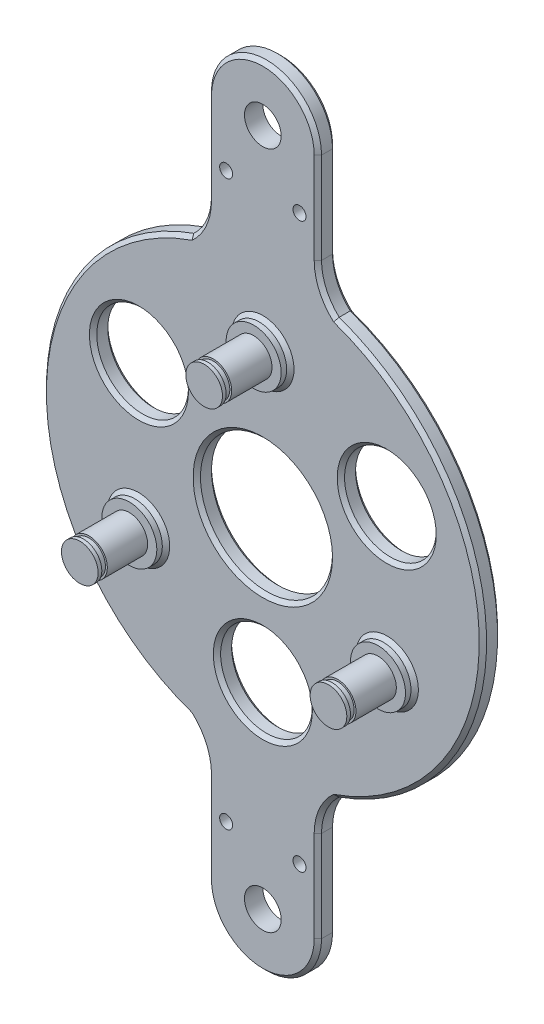
from build123d import *

# Parameters (mm, degrees)
SKETCH1_R                                         = 76.2
BOSS_EXTRUDE1_DEPTH                               = 6.35
SKETCH2_R                                         = 6.35
BOSS_EXTRUDE2_DEPTH                               = 20.32
CIRPATTERN1_COUNT                                 = 3
F_5_8_0_625_DIAMETER_HOLE1_D                      = 15.875
SKETCH11_R                                        = 9.525
BOSS_EXTRUDE3_DEPTH                               = 3.175
CIRPATTERN5_COUNT                                 = 3
CUT_EXTRUDE3_REACH                                = 111.662
SKETCH12_R                                        = 22.86
SKETCH13_W                                        = 1.905
SKETCH13_H                                        = 1.27
CIRPATTERN6_COUNT                                 = 3
CHAMFER1_SIZE                                     = 1.27
CUT_EXTRUDE4_REACH                                = 111.662
SKETCH14_R                                        = 15.875
CIRPATTERN7_COUNT                                 = 3
CHAMFER2_SIZE                                     = 1.27
SKETCH15_W                                        = 38.1
SKETCH15_H                                        = 64.057059502
BOSS_EXTRUDE4_DEPTH                               = 6.35
FILLET1_RADIUS                                    = 19.05
FILLET1_LENGTH                                    = 6.35
BOSS_EXTRUDE5_DEPTH                               = 6.35
F_10_0_5_DIAMETER_HOLE1_D                         = 12.7
CSK_FOR_8_FLAT_HEAD_MACHINE_SCREW_100_D           = 4.4958
CSK_FOR_8_FLAT_HEAD_MACHINE_SCREW_100_CSINK_D     = 8.4328
CSK_FOR_8_FLAT_HEAD_MACHINE_SCREW_100_CSINK_ANGLE = 100
MIRROR3_COPY_1_DEPTH                              = 6.35
FILLET1_OF_MIRROR3_2_RADIUS                       = 19.05
FILLET1_OF_MIRROR3_2_LENGTH                       = 6.35
CHAMFER3_SIZE                                     = 1.27


with BuildPart() as part:
    # Sketch1 → Boss-Extrude1 (new body)
    with BuildSketch(Plane.XY):
        Circle(SKETCH1_R)
    extrude(amount=-BOSS_EXTRUDE1_DEPTH)

    # Sketch2 → Boss-Extrude2 (add)
    with BuildSketch(Plane.XY):
        with Locations((0, 49.7078)):
            Circle(SKETCH2_R)
    boss_extrude2 = extrude(amount=BOSS_EXTRUDE2_DEPTH)

    # CirPattern1: Boss-Extrude2 ×3 about axis
    cirpattern1_axis = Axis((0, 0, 0), (0, 0, 1))
    for i in range(1, CIRPATTERN1_COUNT):
        add(boss_extrude2.rotate(cirpattern1_axis, i * 360 / CIRPATTERN1_COUNT))

    # 5/8 (0.625) Diameter Hole1 (through all)
    with Locations(Plane.XY):
        with Locations((0, 0)):
            Hole(F_5_8_0_625_DIAMETER_HOLE1_D / 2)

    # Sketch11 → Boss-Extrude3 (add)
    with BuildSketch(Plane.XY):
        with Locations((0, 49.7078)):
            Circle(SKETCH11_R)
    boss_extrude3 = extrude(amount=BOSS_EXTRUDE3_DEPTH)

    # CirPattern5: Boss-Extrude3 ×3 about axis
    cirpattern5_axis = Axis((0, 0, 0), (0, 0, 1))
    for i in range(1, CIRPATTERN5_COUNT):
        add(boss_extrude3.rotate(cirpattern5_axis, i * 360 / CIRPATTERN5_COUNT))

    # Sketch12 → Cut-Extrude3 (cut, up to next)
    with BuildSketch(Plane.XY, mode=Mode.PRIVATE) as cut_extrude3_sk1:
        Circle(SKETCH12_R)
    cut_extrude3_tool1 = extrude(cut_extrude3_sk1.sketch, amount=-CUT_EXTRUDE3_REACH, mode=Mode.PRIVATE) & part.part
    add(cut_extrude3_tool1.solids().sort_by_distance((0, 0, 0))[0], mode=Mode.SUBTRACT)

    # Sketch13 → Cut-Revolve1 (revolve, cut)
    with BuildSketch(Plane(origin=(0, 0, 0), x_dir=(0, 0, -1), z_dir=(1, 0, 0)), mode=Mode.PRIVATE) as cut_revolve1_sk:
        with Locations((-18.0975, 56.0578)):
            Rectangle(SKETCH13_W, SKETCH13_H)
    cut_revolve1 = revolve(cut_revolve1_sk.sketch.rotate(Axis((0, 49.7078, 20.32), (0, 0, 1)), 90), axis=Axis((0, 49.7078, 20.32), (0, 0, 1)), mode=Mode.SUBTRACT)

    # CirPattern6: Cut-Revolve1 ×3 about axis
    cirpattern6_axis = Axis((0, 0, 0), (0, 0, 1))
    for i in range(1, CIRPATTERN6_COUNT):
        add(cut_revolve1.rotate(cirpattern6_axis, i * 360 / CIRPATTERN6_COUNT), mode=Mode.SUBTRACT)

    # Chamfer1
    chamfer1_edges = [part.edges().sort_by_distance(p)[0] for p in [
        (-76.2, 0, 0),
        (-9.525, 49.7078, 0),
        (-38.285717566, -33.102791971, 0),
        (47.810717566, -16.605008029, 0),
        (-22.86, 0, -6.35),
        (-22.86, 0, 0),
        (-76.2, 0, -6.35),
    ]]
    chamfer(chamfer1_edges, length=CHAMFER1_SIZE)

    # Sketch14 → Cut-Extrude4 (cut, up to next)
    with BuildSketch(Plane.XY, mode=Mode.PRIVATE) as cut_extrude4_sk1:
        with Locations((42.894238249, 24.765)):
            Circle(SKETCH14_R)
    cut_extrude4_tool1 = extrude(cut_extrude4_sk1.sketch, amount=-CUT_EXTRUDE4_REACH, mode=Mode.PRIVATE) & part.part
    cut_extrude4 = cut_extrude4_tool1.solids().sort_by_distance((42.894238, 24.765, 0))[0]
    add(cut_extrude4, mode=Mode.SUBTRACT)

    # CirPattern7: Cut-Extrude4 ×3 about axis
    cirpattern7_axis = Axis((0, 0, 0), (0, 0, 1))
    for i in range(1, CIRPATTERN7_COUNT):
        add(cut_extrude4.rotate(cirpattern7_axis, i * 360 / CIRPATTERN7_COUNT), mode=Mode.SUBTRACT)

    # Chamfer2
    chamfer2_edges = [part.edges().sort_by_distance(p)[0] for p in [
        (7.9375, -35.781846715, -6.35),
        (27.019238249, 24.765, 0),
        (27.019238249, 24.765, -6.35),
        (-34.956738249, 11.016846715, 0),
        (-34.956738249, 11.016846715, -6.35),
        (7.9375, -35.781846715, 0),
    ]]
    chamfer(chamfer2_edges, length=CHAMFER2_SIZE)

    # Sketch15 → Boss-Extrude4 (add)
    with BuildSketch(Plane.XY):
        with Locations((0, 104.496470249)):
            Rectangle(SKETCH15_W, SKETCH15_H)
    boss_extrude4 = extrude(amount=-BOSS_EXTRUDE4_DEPTH)

    # Fillet1: full round fillet: the end face becomes a half cylinder, R = half its width
    fillet1_face = Plane((0, 136.525, -3.175), x_dir=(0, 0, 1), z_dir=(0, 1, 0))  # on the end face: x along it, z out of the body
    fillet1_slab = fillet1_face.offset(-FILLET1_RADIUS / 2) * Box(FILLET1_LENGTH, 2 * FILLET1_RADIUS, FILLET1_RADIUS, mode=Mode.PRIVATE)  # the body's end, R deep
    fillet1_round = Plane((0, 117.475, -3.175), x_dir=(0, 1, 0), z_dir=(0, 0, 1)) * Cylinder(FILLET1_RADIUS, FILLET1_LENGTH, mode=Mode.PRIVATE)  # its axis R under the face
    add(fillet1_slab - fillet1_round, mode=Mode.SUBTRACT)

    # Sketch16 → Boss-Extrude5 (add)
    with BuildSketch(Plane.XY):
        with BuildLine():
            Line((-19.05, 85.910595388), (-19.05, 72.467940498))
            ThreePointArc((-19.05, 72.467940498), (-24.793169644, 70.709289623), (-30.377027027, 68.496285512))
            ThreePointArc((-30.377027027, 68.496285512), (-22.130887076, 75.523587521), (-19.05, 85.910595388))
        make_face()
    boss_extrude5 = extrude(amount=-BOSS_EXTRUDE5_DEPTH)

    # Mirror1: Boss-Extrude5 across plane
    add(boss_extrude5.mirror(Plane(origin=(0, 0, 0), x_dir=(0, 0, 1), z_dir=(1, 0, 0))))

    # #10 (0.5) Diameter Hole1 (through all)
    with Locations(Plane.XY):
        with Locations((0, 117.475)):
            f_10_0_5_diameter_hole1 = Hole(F_10_0_5_DIAMETER_HOLE1_D / 2)

    # CSK for #8 Flat Head Machine Screw (100)1 (through all)
    with Locations(Plane(origin=(0, 0, -6.35), x_dir=(-1, 0, 0), z_dir=(0, 0, -1))):
        with Locations((12.7, 97.602206046), (-12.7, 97.602206046)):
            csk_for_8_flat_head_machine_screw_100 = CounterSinkHole(CSK_FOR_8_FLAT_HEAD_MACHINE_SCREW_100_D / 2, CSK_FOR_8_FLAT_HEAD_MACHINE_SCREW_100_CSINK_D / 2, counter_sink_angle=CSK_FOR_8_FLAT_HEAD_MACHINE_SCREW_100_CSINK_ANGLE)

    # Mirror3: Boss-Extrude4, Boss-Extrude5, #10 (0.5) Diameter Hole1, CSK for #8 Flat Head Machine Screw (100)1 across plane
    add(boss_extrude4.mirror(Plane.ZX))
    add(boss_extrude5.mirror(Plane.ZX))
    add(f_10_0_5_diameter_hole1.mirror(Plane.ZX), mode=Mode.SUBTRACT)
    add(csk_for_8_flat_head_machine_screw_100.mirror(Plane.ZX), mode=Mode.SUBTRACT)

    # Mirror3 copy 1 sketch → Mirror3 copy 1 (add)
    with BuildSketch(Plane(origin=(0, 0, 0), x_dir=(-1, 0, 0), z_dir=(0, 0, 1))):
        with BuildLine():
            Line((-19.05, 85.910595388), (-19.05, 72.467940498))
            ThreePointArc((-19.05, 72.467940498), (-24.793169644, 70.709289623), (-30.377027027, 68.496285512))
            ThreePointArc((-30.377027027, 68.496285512), (-22.130887076, 75.523587521), (-19.05, 85.910595388))
        make_face()
    extrude(amount=-MIRROR3_COPY_1_DEPTH)

    # Fillet1 of Mirror3 2: full round fillet: the end face becomes a half cylinder, R = half its width
    fillet1_of_mirror3_2_face = Plane((0, -136.525, -3.175), x_dir=(0, 0, 1), z_dir=(0, -1, 0))  # on the end face: x along it, z out of the body
    fillet1_of_mirror3_2_slab = fillet1_of_mirror3_2_face.offset(-FILLET1_OF_MIRROR3_2_RADIUS / 2) * Box(FILLET1_OF_MIRROR3_2_LENGTH, 2 * FILLET1_OF_MIRROR3_2_RADIUS, FILLET1_OF_MIRROR3_2_RADIUS, mode=Mode.PRIVATE)  # the body's end, R deep
    fillet1_of_mirror3_2_round = Plane((0, -117.475, -3.175), x_dir=(0, -1, 0), z_dir=(0, 0, 1)) * Cylinder(FILLET1_OF_MIRROR3_2_RADIUS, FILLET1_OF_MIRROR3_2_LENGTH, mode=Mode.PRIVATE)  # its axis R under the face
    add(fillet1_of_mirror3_2_slab - fillet1_of_mirror3_2_round, mode=Mode.SUBTRACT)

    # Chamfer3
    chamfer3_edges = [part.edges().sort_by_distance(p)[0] for p in [
        (-19.05, 101.692797694, 0),
        (-19.05, 101.692797694, -6.35),
        (0, 136.525, 0),
        (0, 136.525, -6.35),
        (-22.130887076, 75.523587521, -6.35),
        (-22.130887076, 75.523587521, 0),
        (19.05, 101.692797694, -6.35),
        (19.05, 101.692797694, 0),
        (22.130887076, 75.523587521, 0),
        (22.130887076, 75.523587521, -6.35),
        (-19.05, -101.692797694, -6.35),
        (-19.05, -101.692797694, 0),
        (0, -136.525, -6.35),
        (0, -136.525, 0),
        (-22.130887076, -75.523587521, 0),
        (-22.130887076, -75.523587521, -6.35),
        (19.05, -101.692797694, 0),
        (19.05, -101.692797694, -6.35),
        (22.130887076, -75.523587521, -6.35),
        (22.130887076, -75.523587521, 0),
    ]]
    chamfer(chamfer3_edges, length=CHAMFER3_SIZE)


solid = part.part
